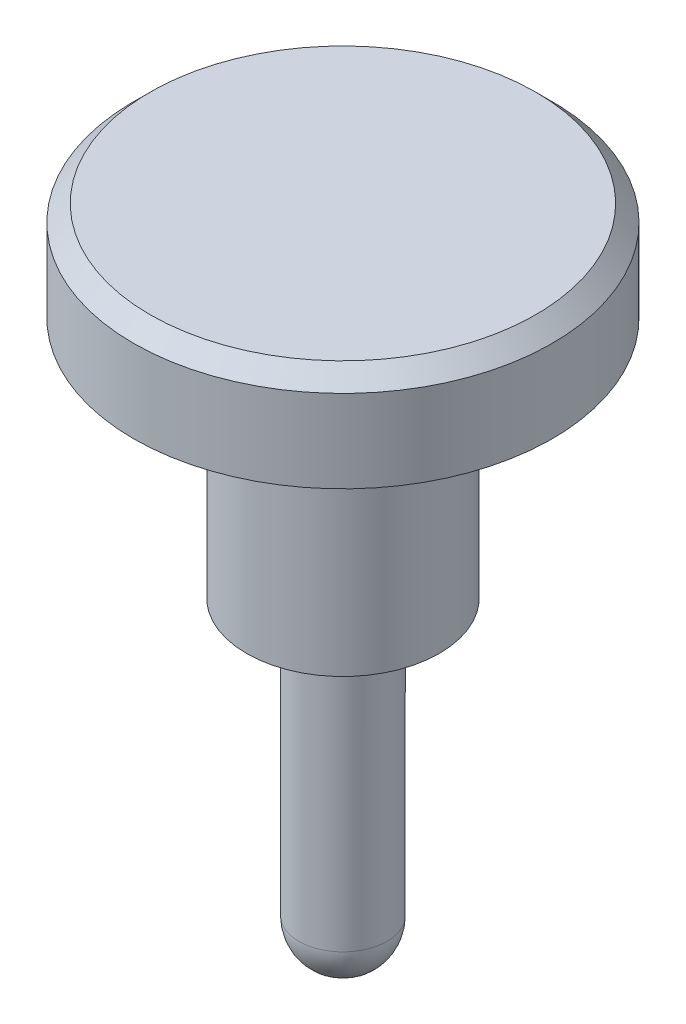
from build123d import *

# Parameters (mm, degrees)
SKETCH1_W = 8
SKETCH1_H = 50


with BuildPart() as part:
    # Sketch1 → Revolve1 (revolve)
    with BuildSketch(Plane.XY, mode=Mode.PRIVATE) as revolve1_sk:
        Polygon((35, 18), (0, 18), (0, 15), (38, 15), align=None)
        Polygon((38, 15), (0, 15), (0, 0), (17.5, 0), (38, 0), align=None)
        Polygon((17.5, 0), (0, 0), (0, -44), (8, -44), (17.5, -44), align=None)
        with Locations((4, -69)):
            Rectangle(SKETCH1_W, SKETCH1_H)
        with BuildLine():
            ThreePointArc((8, -94), (5.656854249, -99.656854249), (0, -102))
            Line((0, -102), (0, -94))
            Line((0, -94), (8, -94))
        make_face()
    revolve(revolve1_sk.sketch.rotate(Axis((0, 67.717923126, 0), (0, -1, 0)), 90), axis=Axis((0, 67.717923126, 0), (0, -1, 0)))


solid = part.part
